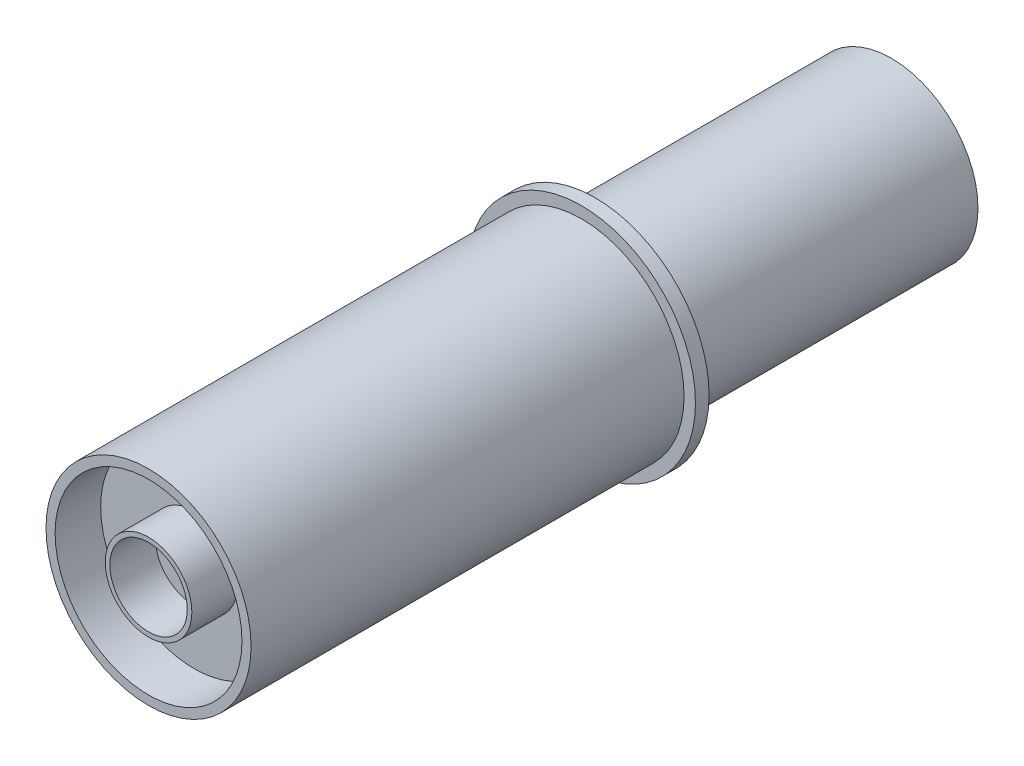
from build123d import *

# Parameters (mm, degrees)
SKETCH1_R           = 19
BOSS_EXTRUDE1_DEPTH = 65
SKETCH2_R           = 25
BOSS_EXTRUDE2_DEPTH = 3
SKETCH3_R           = 22.5
BOSS_EXTRUDE3_DEPTH = 95
SKETCH4_R           = 20.5
CUT_EXTRUDE1_DEPTH  = 10
SKETCH5_R           = 9.5
SKETCH5_R_2         = 8.5
BOSS_EXTRUDE4_DEPTH = 10


with BuildPart() as part:
    # Sketch1 → Boss-Extrude1 (new body)
    with BuildSketch(Plane.XY):
        with Locations((-114.166758924, 45.66670357)):
            Circle(SKETCH1_R)
    extrude(amount=BOSS_EXTRUDE1_DEPTH)

    # Sketch2 → Boss-Extrude2 (add)
    with BuildSketch(Plane.XY.offset(65)):
        with Locations((-114.166758924, 45.66670357)):
            Circle(SKETCH2_R)
    extrude(amount=BOSS_EXTRUDE2_DEPTH)

    # Sketch3 → Boss-Extrude3 (add)
    with BuildSketch(Plane.XY.offset(68)):
        with Locations((-114.166758924, 45.66670357)):
            Circle(SKETCH3_R)
    extrude(amount=BOSS_EXTRUDE3_DEPTH)

    # Sketch4 → Cut-Extrude1 (cut)
    with BuildSketch(Plane.XY.offset(163)):
        with Locations((-114.166758924, 45.66670357)):
            Circle(SKETCH4_R)
    extrude(amount=-CUT_EXTRUDE1_DEPTH, mode=Mode.SUBTRACT)

    # Sketch5 → Boss-Extrude4 (add)
    with BuildSketch(Plane.XY.offset(153)):
        with Locations((-114.166758924, 45.66670357)):
            Circle(SKETCH5_R)
        with Locations((-114.166758924, 45.66670357)):
            Circle(SKETCH5_R_2, mode=Mode.SUBTRACT)
    extrude(amount=BOSS_EXTRUDE4_DEPTH)


solid = part.part
